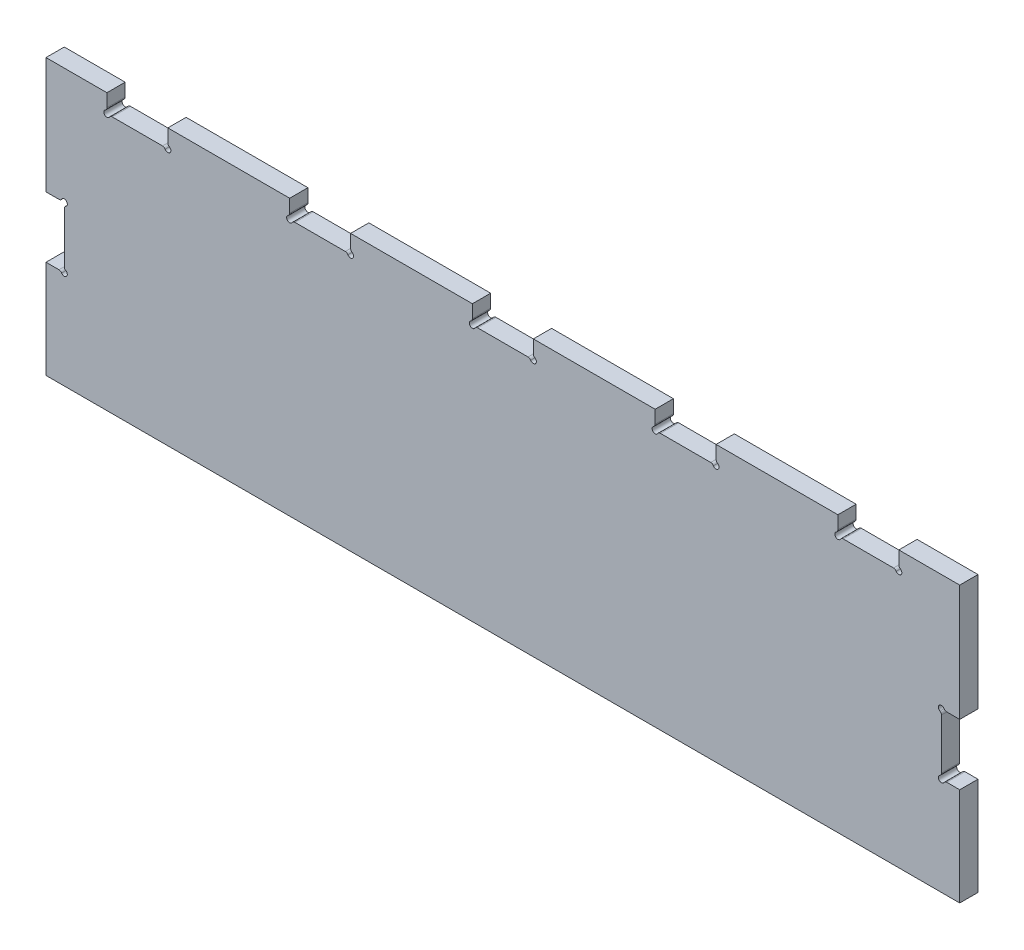
from build123d import *

# Parameters (mm, degrees)
BOSS_EXTRUDE1_DEPTH = 1.5
SKETCH2_R           = 0.5
CUT_EXTRUDE1_DEPTH  = 88.618719461
FILLET1_R           = 0.5


with BuildPart() as part:
    # Sketch1 → Boss-Extrude1 (new, symmetric)
    with BuildSketch(Plane.XY):
        Polygon((65, -3), (65, 0), (75, 0), (75, -19.1), (72, -19.1), (72, -29.1), (75, -29.1), (75, -45.2), (-75, -45.2), (-75, -29.1), (-72, -29.1), (-72, -19.1), (-75, -19.1), (-75, 0), (-65, 0), (-65, -3), (-55, -3), (-55, 0), (-35, 0), (-35, -3), (-25, -3), (-25, 0), (-5, 0), (-5, -3), (5, -3), (5, 0), (25, 0), (25, -3), (35, -3), (35, 0), (55, 0), (55, -3), align=None)
    extrude(amount=BOSS_EXTRUDE1_DEPTH, both=True)

    # Sketch2 → Cut-Extrude1 (cut, through all)
    with BuildSketch(Plane.XY.offset(1.5)):
        with Locations((-72, -29.1)):
            Circle(SKETCH2_R)
        with Locations((-72, -19.1)):
            Circle(SKETCH2_R)
        with Locations((-65, -3)):
            Circle(SKETCH2_R)
        with Locations((-55, -3)):
            Circle(SKETCH2_R)
        with Locations((-35, -3)):
            Circle(SKETCH2_R)
        with Locations((-25, -3)):
            Circle(SKETCH2_R)
        with Locations((-5, -3)):
            Circle(SKETCH2_R)
        with Locations((5, -3)):
            Circle(SKETCH2_R)
        with Locations((25, -3)):
            Circle(SKETCH2_R)
        with Locations((35, -3)):
            Circle(SKETCH2_R)
        with Locations((55, -3)):
            Circle(SKETCH2_R)
        with Locations((65, -3)):
            Circle(SKETCH2_R)
        with Locations((72, -19.1)):
            Circle(SKETCH2_R)
        with Locations((72, -29.1)):
            Circle(SKETCH2_R)
    extrude(amount=-CUT_EXTRUDE1_DEPTH, mode=Mode.SUBTRACT)

    # Fillet1
    fillet1_edges = [part.edges().sort_by_distance(p)[0] for p in [
        (72.5, -29.1, 0),
        (72, -28.6, 0),
        (72, -19.6, 0),
        (72.5, -19.1, 0),
        (65, -2.5, 0),
        (64.5, -3, 0),
        (55.5, -3, 0),
        (55, -2.5, 0),
        (35, -2.5, 0),
        (34.5, -3, 0),
        (25.5, -3, 0),
        (25, -2.5, 0),
        (5, -2.5, 0),
        (4.5, -3, 0),
        (-4.5, -3, 0),
        (-5, -2.5, 0),
        (-25, -2.5, 0),
        (-25.5, -3, 0),
        (-34.5, -3, 0),
        (-35, -2.5, 0),
        (-55, -2.5, 0),
        (-55.5, -3, 0),
        (-64.5, -3, 0),
        (-65, -2.5, 0),
        (-72.5, -19.1, 0),
        (-72, -19.6, 0),
        (-72, -28.6, 0),
        (-72.5, -29.1, 0),
    ]]
    fillet(fillet1_edges, radius=FILLET1_R)


solid = part.part
